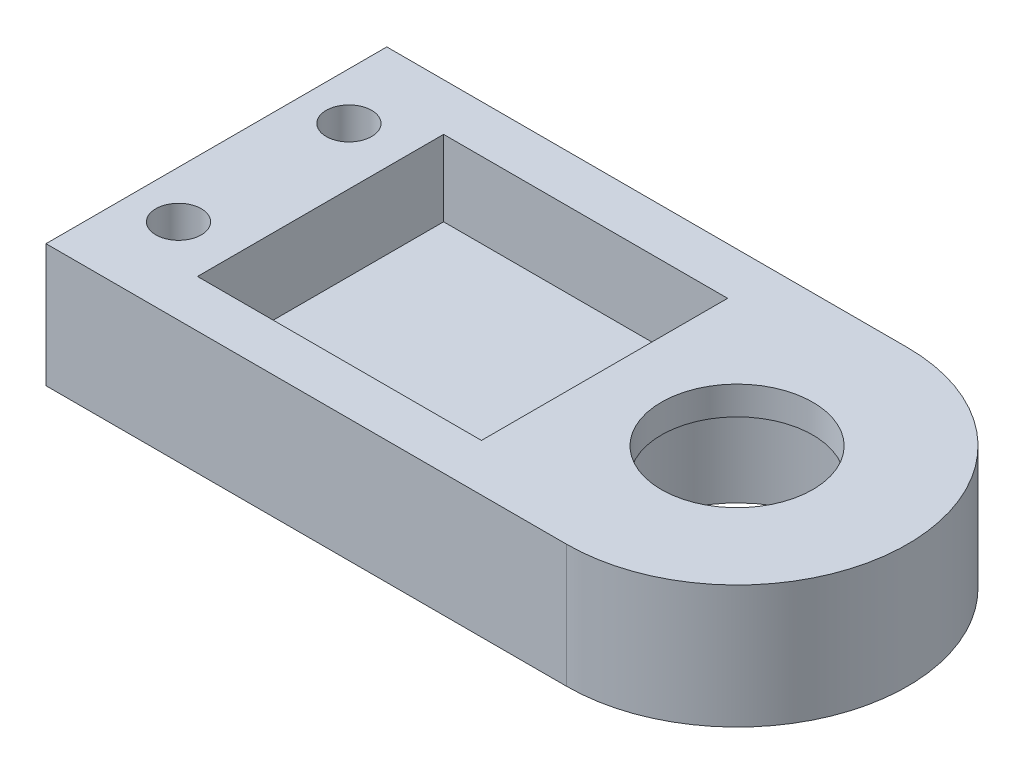
from build123d import *

# Parameters (mm, degrees)
BOSS_EXTRUDE1_DEPTH  = 6.5
SKETCH2_R            = 5.5
CUT_EXTRUDE2_DEPTH   = 5
SKETCH3_R            = 4
CUT_EXTRUDE4_DEPTH   = 1.5
M2_CLEARANCE_HOLE1_D = 2.4
M2_CLEARANCE_HOLE2_D = 2.4
SKETCH8_W            = 15
SKETCH8_H            = 13
CUT_EXTRUDE5_DEPTH   = 4


with BuildPart() as part:
    # Sketch1 → Boss-Extrude1 (new body)
    with BuildSketch(Plane(origin=(0, 24.8, 0), x_dir=(1, 0, 0), z_dir=(0, 1, 0))):
        with BuildLine():
            Line((5.5, 9), (-22, 9))
            Line((-22, 9), (-22, -9))
            Line((-22, -9), (5.5, -9))
            ThreePointArc((5.5, -9), (14.5, 0), (5.5, 9))
        make_face()
    extrude(amount=BOSS_EXTRUDE1_DEPTH)

    # Sketch2 → Cut-Extrude2 (cut)
    with BuildSketch(Plane(origin=(0, 24.8, 0), x_dir=(1, 0, 0), z_dir=(0, 1, 0))):
        with Locations(Location((5.5, 0, 0), (0, 0, 270))):
            Circle(SKETCH2_R)
    extrude(amount=CUT_EXTRUDE2_DEPTH, mode=Mode.SUBTRACT)

    # Sketch3 → Cut-Extrude4 (cut)
    with BuildSketch(Plane(origin=(0, 29.8, 0), x_dir=(1, 0, 0), z_dir=(0, 1, 0))):
        with Locations(Location((5.5, 0, 0), (0, 0, 270))):
            Circle(SKETCH3_R)
    extrude(amount=CUT_EXTRUDE4_DEPTH, mode=Mode.SUBTRACT)

    # M2 Clearance Hole1 (through all)
    with Locations(Plane(origin=(0, 31.3, 0), x_dir=(1, 0, 0), z_dir=(0, 1, 0))):
        with Locations((-19.5, -4.5)):
            Hole(M2_CLEARANCE_HOLE1_D / 2)

    # M2 Clearance Hole2 (through all)
    with Locations(Plane(origin=(0, 31.3, 0), x_dir=(1, 0, 0), z_dir=(0, 1, 0))):
        with Locations((-19.5, 4.5)):
            Hole(M2_CLEARANCE_HOLE2_D / 2)

    # Sketch8 → Cut-Extrude5 (cut)
    with BuildSketch(Plane(origin=(0, 31.3, 0), x_dir=(1, 0, 0), z_dir=(0, 1, 0))):
        with Locations((-9, 0)):
            Rectangle(SKETCH8_W, SKETCH8_H)
    extrude(amount=-CUT_EXTRUDE5_DEPTH, mode=Mode.SUBTRACT)


solid = part.part
